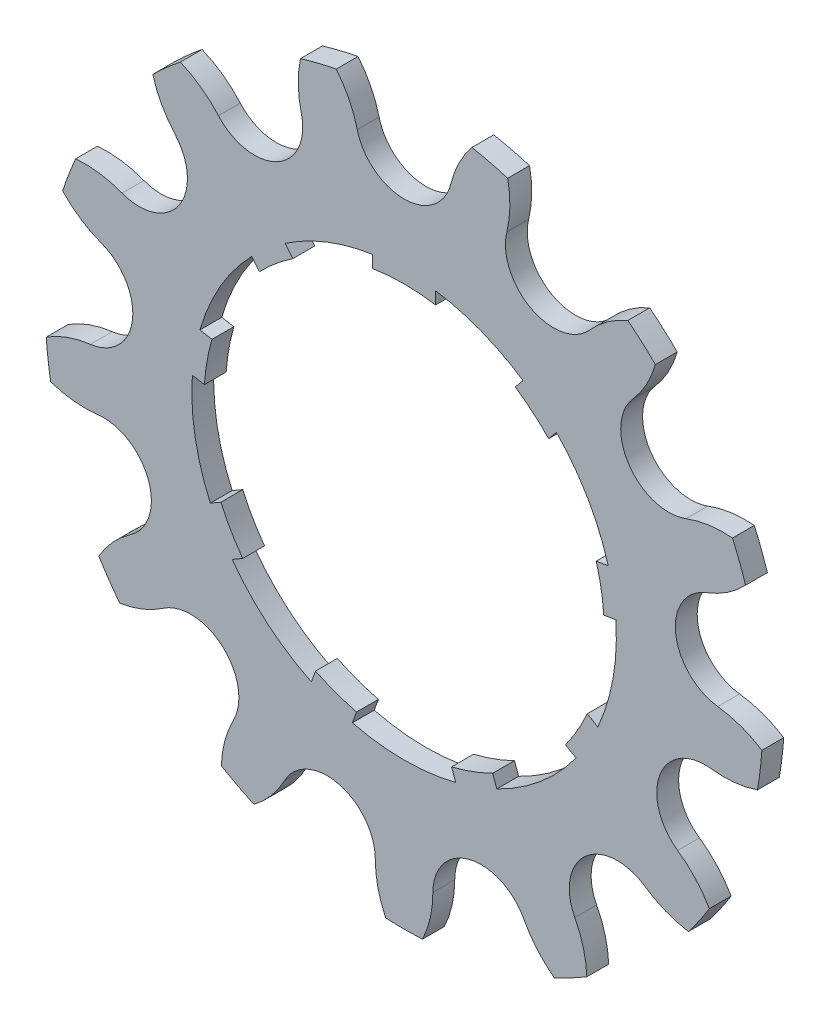
from build123d import *

# Parameters (mm, degrees)
SK_DISCO_R           = 29.572962734
DISCO_DEPTH          = 1.8
HUECO_DIENTE_DEPTH   = 42.861202201
MATRIZ_DIENTES_COUNT = 13


with BuildPart() as part:
    # Sk_Disco → Disco (new body)
    with BuildSketch(Plane.XY):
        Circle(SK_DISCO_R)
        with BuildLine():
            Line((2.6, 17.305779381), (2.6, 16.293863876))
            ThreePointArc((2.6, 16.293863876), (0, 16.5), (-2.6, 16.293863876))
            Line((-2.6, 16.293863876), (-2.6, 17.305779381))
            ThreePointArc((-2.6, 17.305779381), (-6.362648192, 16.302352836), (-9.810241185, 14.491693065))
            Line((-9.810241185, 14.491693065), (-9.163816615, 13.721314261))
            ThreePointArc((-9.163816615, 13.721314261), (-10.60599556, 12.639733311), (-11.92157661, 11.407278866))
            Line((-11.92157661, 11.407278866), (-12.56800118, 12.17765767))
            ThreePointArc((-12.56800118, 12.17765767), (-15.155444566, 8.75), (-16.830161491, 4.795379462))
            Line((-16.830161491, 4.795379462), (-15.839781591, 4.620748764))
            ThreePointArc((-15.839781591, 4.620748764), (-16.249327925, 2.865194932), (-16.464915031, 1.075440854))
            Line((-16.464915031, 1.075440854), (-17.455294931, 1.250071551))
            ThreePointArc((-17.455294931, 1.250071551), (-17.234135678, -3.038843109), (-15.975062189, -7.144745486))
            Line((-15.975062189, -7.144745486), (-15.104136721, -6.641916433))
            ThreePointArc((-15.104136721, -6.641916433), (-14.289419162, -8.25), (-13.304136721, -9.759607887))
            Line((-13.304136721, -9.759607887), (-14.175062189, -10.26243694))
            ThreePointArc((-14.175062189, -10.26243694), (-11.24878317, -13.405777755), (-7.645053746, -15.741764616))
            Line((-7.645053746, -15.741764616), (-7.301098416, -14.796755115))
            ThreePointArc((-7.301098416, -14.796755115), (-5.643332365, -15.504928243), (-3.918204981, -16.028027631))
            Line((-3.918204981, -16.028027631), (-4.262160311, -16.973037132))
            ThreePointArc((-4.262160311, -16.973037132), (0, -17.5), (4.262160311, -16.973037132))
            Line((4.262160311, -16.973037132), (3.918204981, -16.028027631))
            ThreePointArc((3.918204981, -16.028027631), (5.643332365, -15.504928243), (7.301098416, -14.796755115))
            Line((7.301098416, -14.796755115), (7.645053746, -15.741764616))
            ThreePointArc((7.645053746, -15.741764616), (11.24878317, -13.405777755), (14.175062189, -10.26243694))
            Line((14.175062189, -10.26243694), (13.304136721, -9.759607887))
            ThreePointArc((13.304136721, -9.759607887), (14.289419162, -8.25), (15.104136721, -6.641916433))
            Line((15.104136721, -6.641916433), (15.975062189, -7.144745486))
            ThreePointArc((15.975062189, -7.144745486), (17.234135678, -3.038843109), (17.455294931, 1.250071551))
            Line((17.455294931, 1.250071551), (16.464915031, 1.075440854))
            ThreePointArc((16.464915031, 1.075440854), (16.249327925, 2.865194932), (15.839781591, 4.620748764))
            Line((15.839781591, 4.620748764), (16.830161491, 4.795379462))
            ThreePointArc((16.830161491, 4.795379462), (15.155444566, 8.75), (12.56800118, 12.17765767))
            Line((12.56800118, 12.17765767), (11.92157661, 11.407278866))
            ThreePointArc((11.92157661, 11.407278866), (10.60599556, 12.639733311), (9.163816615, 13.721314261))
            Line((9.163816615, 13.721314261), (9.810241185, 14.491693065))
            ThreePointArc((9.810241185, 14.491693065), (6.362648192, 16.302352836), (2.6, 17.305779381))
        make_face(mode=Mode.SUBTRACT)
    extrude(amount=DISCO_DEPTH)

    # Sk_Hueco → Hueco_diente (cut, through all)
    with BuildSketch(Plane.XY):
        with BuildLine():
            ThreePointArc((-3.859493724, 25.582712562), (0, 22.558992327), (3.859493724, 25.582712562))
            ThreePointArc((3.859493724, 25.582712562), (5.159504407, 28.464173723), (7.400896702, 30.693300634))
            ThreePointArc((7.400896702, 30.693300634), (0, 31.572962734), (-7.400896702, 30.693300634))
            ThreePointArc((-7.400896702, 30.693300634), (-5.159504407, 28.464173723), (-3.859493724, 25.582712562))
        make_face()
    hueco_diente = extrude(amount=HUECO_DIENTE_DEPTH, mode=Mode.SUBTRACT)

    # Matriz_dientes: Hueco_diente ×13 about axis
    matriz_dientes_axis = Axis((0, 0, -0.09), (0, 0, 1))
    for i in range(1, MATRIZ_DIENTES_COUNT):
        add(hueco_diente.rotate(matriz_dientes_axis, i * 360 / MATRIZ_DIENTES_COUNT), mode=Mode.SUBTRACT)


solid = part.part
